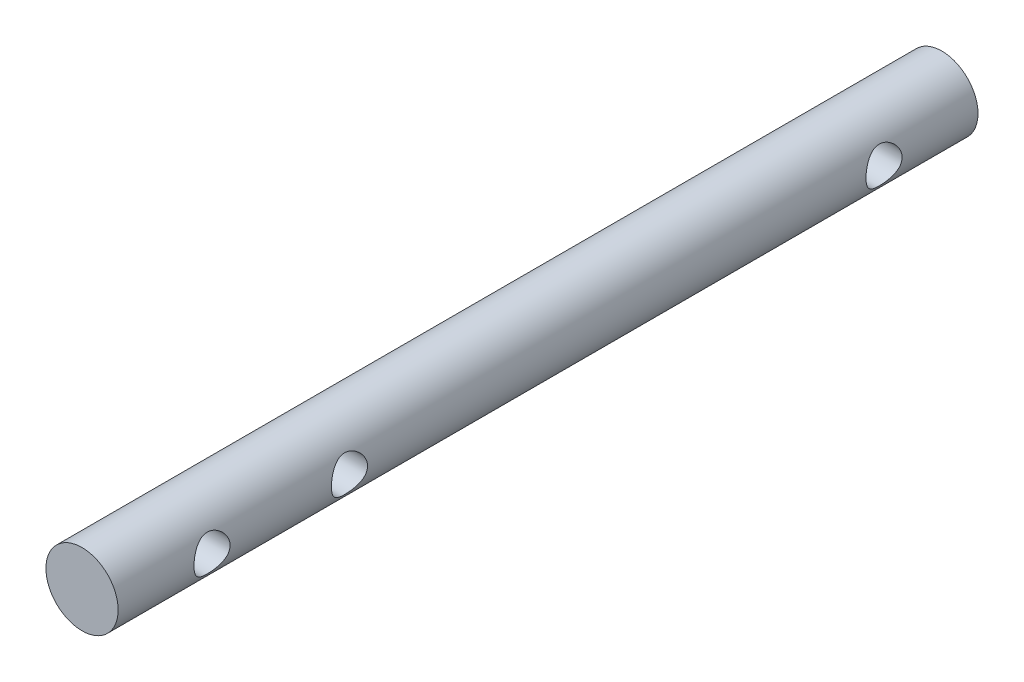
from build123d import *

# Parameters (mm, degrees)
SKETCH2_R                       = 4.995
BOSS_EXTRUDE1_DEPTH             = 119
F_5_0MM_DOWEL_HOLE1_D           = 5
F_5_0MM_DOWEL_HOLE1_CSINK_D     = 5.05
F_5_0MM_DOWEL_HOLE1_CSINK_ANGLE = 90
F_5_0MM_DOWEL_HOLE2_D           = 5
F_5_0MM_DOWEL_HOLE2_CSINK_D     = 5.05
F_5_0MM_DOWEL_HOLE2_CSINK_ANGLE = 90


with BuildPart() as part:
    # Sketch2 → Boss-Extrude1 (new body)
    with BuildSketch(Plane.XY):
        Circle(SKETCH2_R)
    extrude(amount=BOSS_EXTRUDE1_DEPTH)

    # Ø5.0mm Dowel Hole1 (through all)
    with Locations(Plane.ZY.offset(4.995)):
        with Locations((13, 0)):
            f_5_0mm_dowel_hole1 = CounterSinkHole(F_5_0MM_DOWEL_HOLE1_D / 2, F_5_0MM_DOWEL_HOLE1_CSINK_D / 2, counter_sink_angle=F_5_0MM_DOWEL_HOLE1_CSINK_ANGLE)

    # Mirror1: Ø5.0mm Dowel Hole1 across plane
    add(f_5_0mm_dowel_hole1.mirror(Plane(origin=(0, 0, 59.5), x_dir=(1, 0, 0), z_dir=(0, 0, -1))), mode=Mode.SUBTRACT)

    # Ø5.0mm Dowel Hole2 (through all)
    with Locations(Plane.ZY.offset(4.995)):
        with Locations((86.98, 0)):
            CounterSinkHole(F_5_0MM_DOWEL_HOLE2_D / 2, F_5_0MM_DOWEL_HOLE2_CSINK_D / 2, counter_sink_angle=F_5_0MM_DOWEL_HOLE2_CSINK_ANGLE)


solid = part.part
